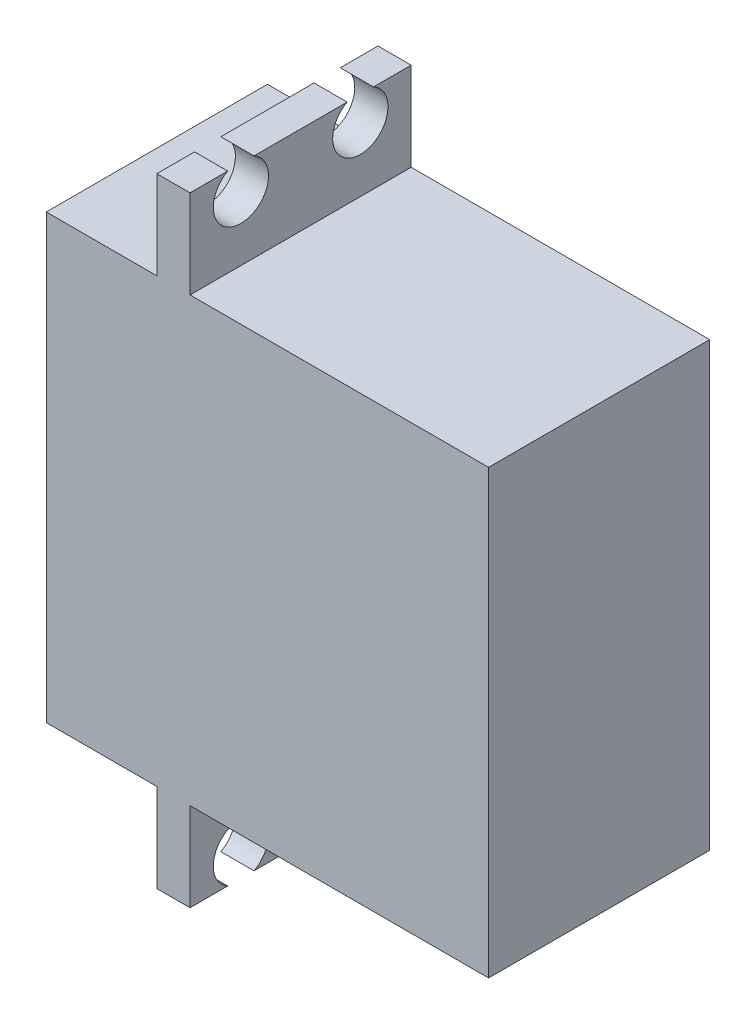
from build123d import *

# Parameters (mm, degrees)
ESQUISSE1_W              = 40
ESQUISSE1_H              = 40
BOSS_EXTRU_1_DEPTH       = 20
ESQUISSE2_W              = 3
ESQUISSE2_H              = 20
BOSS_EXTRU_2_DEPTH       = 8
ESQUISSE3_W              = 3
ESQUISSE3_H              = 20
BOSS_EXTRU_4_DEPTH       = 8
ESQUISSE5_R              = 2.5
ENL_V_MAT_EXTRU_9_DEPTH  = 8
ESQUISSE6_R              = 2.5
ENL_V_MAT_EXTRU_10_DEPTH = 8
ESQUISSE7_R              = 2.95
BOSS_EXTRU_5_DEPTH       = 5


with BuildPart() as part:
    # Esquisse1 → Boss.-Extru.1 (new body)
    with BuildSketch(Plane.XY):
        Rectangle(ESQUISSE1_W, ESQUISSE1_H)
    extrude(amount=BOSS_EXTRU_1_DEPTH)

    # Esquisse2 → Boss.-Extru.2 (add)
    with BuildSketch(Plane(origin=(0, 20, 0), x_dir=(1, 0, 0), z_dir=(0, 1, 0))):
        with Locations((-8.5, -10)):
            Rectangle(ESQUISSE2_W, ESQUISSE2_H)
    extrude(amount=BOSS_EXTRU_2_DEPTH)

    # Esquisse3 → Boss.-Extru.4 (add)
    with BuildSketch(Plane.XZ.offset(20)):
        with Locations((-8.5, 10)):
            Rectangle(ESQUISSE3_W, ESQUISSE3_H)
    extrude(amount=BOSS_EXTRU_4_DEPTH)

    # Esquisse5 → Enlèv. mat.-Extru.9 (cut)
    with BuildSketch(Plane.ZY.offset(10)):
        with Locations((4.6, -25.8)):
            Circle(ESQUISSE5_R)
        with Locations((15.4, -25.8)):
            Circle(ESQUISSE5_R)
    extrude(amount=-ENL_V_MAT_EXTRU_9_DEPTH, mode=Mode.SUBTRACT)

    # Esquisse6 → Enlèv. mat.-Extru.10 (cut)
    with BuildSketch(Plane.ZY.offset(10)):
        with Locations((4.6, 25.8)):
            Circle(ESQUISSE6_R)
        with Locations((15.4, 25.8)):
            Circle(ESQUISSE6_R)
    extrude(amount=-ENL_V_MAT_EXTRU_10_DEPTH, mode=Mode.SUBTRACT)

    # Esquisse7 → Boss.-Extru.5 (add)
    with BuildSketch(Plane.ZY.offset(20)):
        with Locations(Location((10, 10, 0), (0, 0, 180))):
            Circle(ESQUISSE7_R)
    extrude(amount=BOSS_EXTRU_5_DEPTH)


solid = part.part
